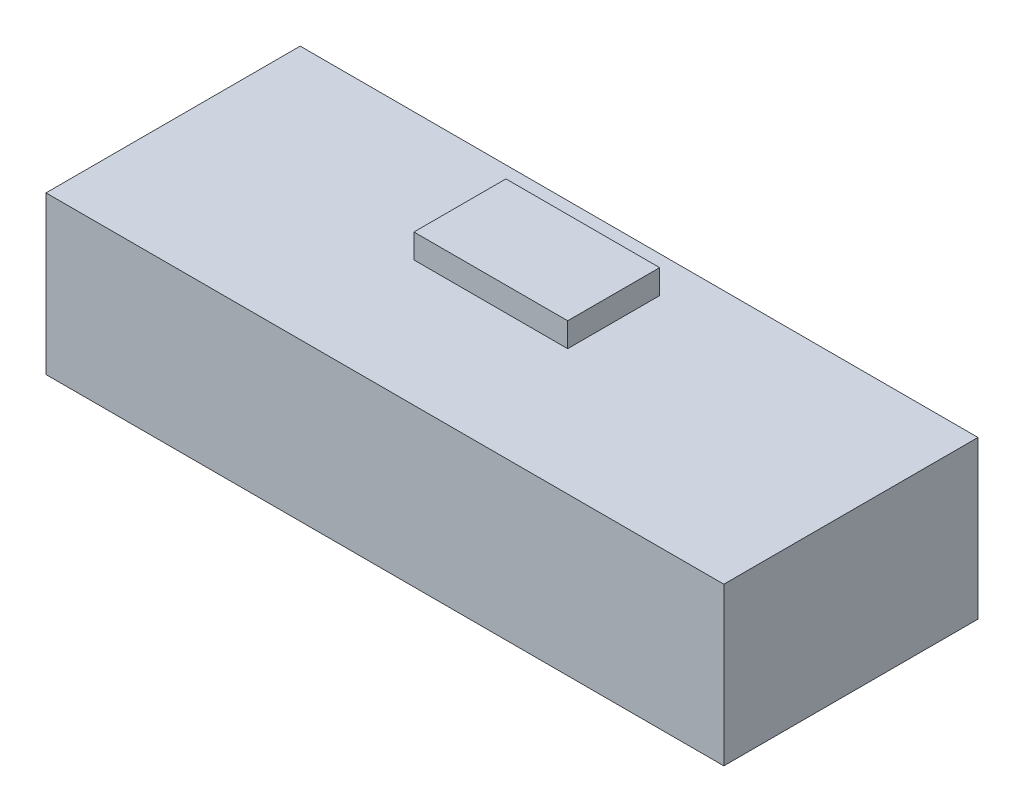
from build123d import *

# Parameters (mm, degrees)
SK_P01_F2INLINEHOLDER5A_W        = 56
SK_P01_F2INLINEHOLDER5A_H        = 21
P01_F2INLINEHOLDER5A_DEPTH       = 13
P02_D1IDEALDIODEPOLOLU5382_START = 13
SK_P02_D1IDEALDIODEPOLOLU5382_W  = 12.7
SK_P02_D1IDEALDIODEPOLOLU5382_H  = 7.6
P02_D1IDEALDIODEPOLOLU5382_DEPTH = 2


with BuildPart() as part:
    # SK_P01_F2inlineholder5A → P01_F2inlineholder5A (new body)
    with BuildSketch(Plane(origin=(0, 0, 0), x_dir=(1, 0, 0), z_dir=(0, 1, 0))):
        Rectangle(SK_P01_F2INLINEHOLDER5A_W, SK_P01_F2INLINEHOLDER5A_H)
    extrude(amount=P01_F2INLINEHOLDER5A_DEPTH)

    # SK_P02_D1idealdiodePololu5382 → P02_D1idealdiodePololu5382 (add)
    with BuildSketch(Plane(origin=(0, 0, 0), x_dir=(1, 0, 0), z_dir=(0, 1, 0)).offset(P02_D1IDEALDIODEPOLOLU5382_START)):
        with Locations((-1.65, 3.7)):
            Rectangle(SK_P02_D1IDEALDIODEPOLOLU5382_W, SK_P02_D1IDEALDIODEPOLOLU5382_H)
    extrude(amount=P02_D1IDEALDIODEPOLOLU5382_DEPTH)


solid = part.part
